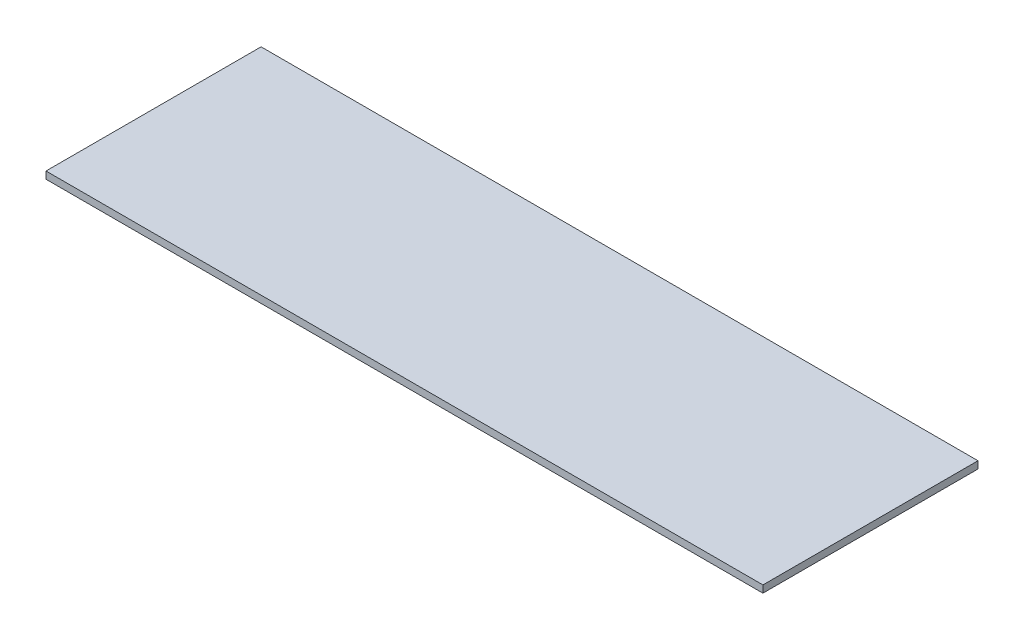
from build123d import *

# Parameters (mm, degrees)
SKETCH1_W           = 200
SKETCH1_H           = 60
BOSS_EXTRUDE1_DEPTH = 2


with BuildPart() as part:
    # Sketch1 → Boss-Extrude1 (new body)
    with BuildSketch(Plane(origin=(0, 0, 0), x_dir=(1, 0, 0), z_dir=(0, 1, 0))):
        with Locations((-20.346320346, 4.632034632)):
            Rectangle(SKETCH1_W, SKETCH1_H)
    extrude(amount=BOSS_EXTRUDE1_DEPTH)


solid = part.part
